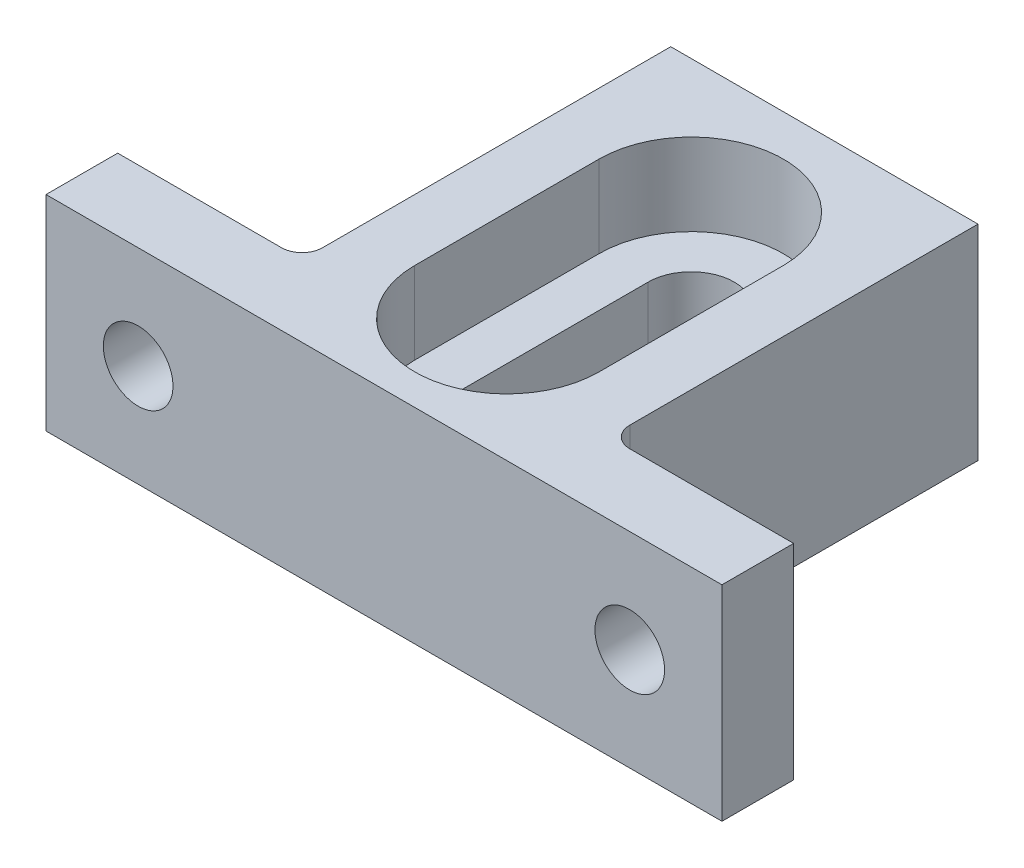
from build123d import *

# Parameters (mm, degrees)
BOSS_EXTRUDE1_DEPTH  = 5
CUT_EXTRUDE1_DEPTH   = 4
CUT_EXTRUDE2_DEPTH   = 29.887713651
M3_CLEARANCE_HOLE1_D = 3.4
FILLET1_R            = 1


with BuildPart() as part:
    # Sketch1 → Boss-Extrude1 (new, symmetric)
    with BuildSketch(Plane(origin=(0, 0, 0), x_dir=(1, 0, 0), z_dir=(0, 1, 0))):
        Polygon((-7.5, 21.5), (7.5, 21.5), (7.5, 3.5), (16.5, 3.5), (16.5, 0), (-16.5, 0), (-16.5, 3.5), (-7.5, 3.5), align=None)
    extrude(amount=BOSS_EXTRUDE1_DEPTH, both=True)

    # Sketch3 → Cut-Extrude1 (cut)
    with BuildSketch(Plane(origin=(0, 5, 0), x_dir=(1, 0, 0), z_dir=(0, 1, 0))):
        with BuildLine():
            Line((4.5, 6), (4.5, 15))
            ThreePointArc((4.5, 15), (0, 19.5), (-4.5, 15))
            Line((-4.5, 15), (-4.5, 6))
            ThreePointArc((-4.5, 6), (0, 1.5), (4.5, 6))
        make_face()
    extrude(amount=-CUT_EXTRUDE1_DEPTH, mode=Mode.SUBTRACT)

    # Sketch4 → Cut-Extrude2 (cut, through all)
    with BuildSketch(Plane(origin=(0, 5, 0), x_dir=(1, 0, 0), z_dir=(0, 1, 0))):
        with BuildLine():
            Line((2.1, 6), (2.1, 15))
            ThreePointArc((2.1, 15), (0, 17.1), (-2.1, 15))
            Line((-2.1, 15), (-2.1, 6))
            ThreePointArc((-2.1, 6), (0, 3.9), (2.1, 6))
        make_face()
    extrude(amount=-CUT_EXTRUDE2_DEPTH, mode=Mode.SUBTRACT)

    # M3 Clearance Hole1 (through all)
    with Locations(Plane(origin=(0, 0, -3.5), x_dir=(-1, 0, 0), z_dir=(0, 0, -1))):
        with Locations((-12, 0), (12, 0)):
            Hole(M3_CLEARANCE_HOLE1_D / 2)

    # Fillet1
    fillet1_edges = [part.edges().sort_by_distance(p)[0] for p in [
        (-7.5, 0, -3.5),
        (7.5, 0, -3.5),
    ]]
    fillet(fillet1_edges, radius=FILLET1_R)


solid = part.part
